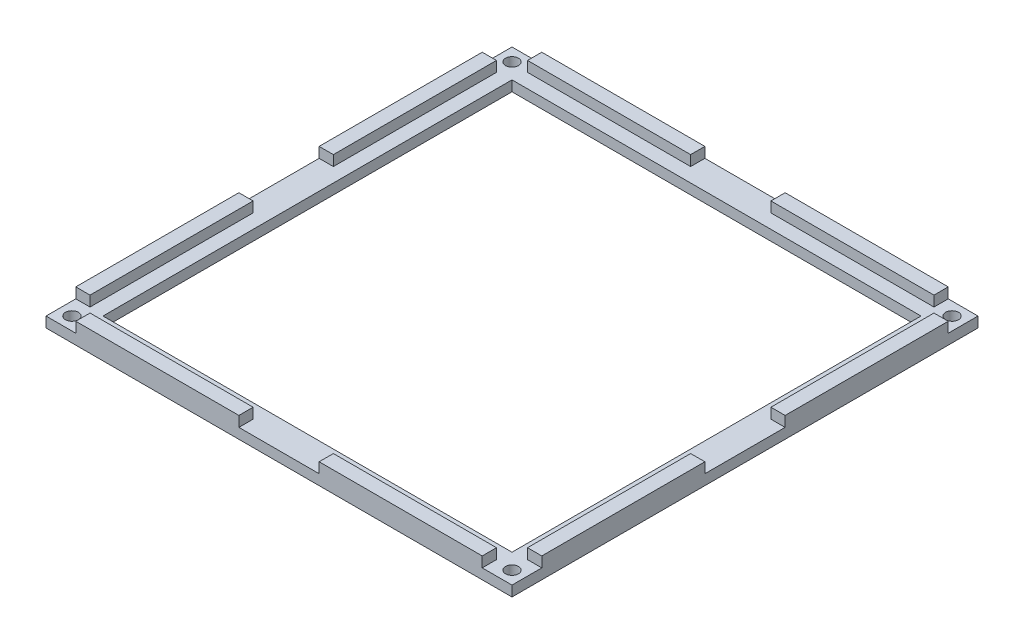
from build123d import *

# Parameters (mm, degrees)
CROQUIS1_W              = 180
CROQUIS1_H              = 180
CROQUIS1_R              = 2.5
CROQUIS1_W_2            = 158
CROQUIS1_H_2            = 158
SALIENTE_EXTRUIR1_DEPTH = 4
CROQUIS2_W              = 5.5
CROQUIS2_H              = 63
CROQUIS2_W_2            = 63
CROQUIS2_H_2            = 5.5
SALIENTE_EXTRUIR2_DEPTH = 4


with BuildPart() as part:
    # Croquis1 → Saliente-Extruir1 (new body)
    with BuildSketch(Plane(origin=(0, 0, 0), x_dir=(1, 0, 0), z_dir=(0, 1, 0))):
        with Locations((90, 90)):
            Rectangle(CROQUIS1_W, CROQUIS1_H)
        with Locations(Location((5, 175, 0), (0, 0, 270))):
            Circle(CROQUIS1_R, mode=Mode.SUBTRACT)
        with Locations(Location((175, 175, 0), (0, 0, 270))):
            Circle(CROQUIS1_R, mode=Mode.SUBTRACT)
        with Locations(Location((175, 5, 0), (0, 0, 270))):
            Circle(CROQUIS1_R, mode=Mode.SUBTRACT)
        with Locations(Location((5, 5, 0), (0, 0, 270))):
            Circle(CROQUIS1_R, mode=Mode.SUBTRACT)
        with Locations((90, 90)):
            Rectangle(CROQUIS1_W_2, CROQUIS1_H_2, mode=Mode.SUBTRACT)
    extrude(amount=SALIENTE_EXTRUIR1_DEPTH)

    # Croquis2 → Saliente-Extruir2 (add)
    with BuildSketch(Plane(origin=(0, 4, 0), x_dir=(1, 0, 0), z_dir=(0, 1, 0))):
        with Locations((2.75, 137)):
            Rectangle(CROQUIS2_W, CROQUIS2_H)
        with Locations((43, 177.25)):
            Rectangle(CROQUIS2_W_2, CROQUIS2_H_2)
        with Locations((137, 177.25)):
            Rectangle(CROQUIS2_W_2, CROQUIS2_H_2)
        with Locations((177.25, 137)):
            Rectangle(CROQUIS2_W, CROQUIS2_H)
        with Locations((177.25, 43)):
            Rectangle(CROQUIS2_W, CROQUIS2_H)
        with Locations((137, 2.75)):
            Rectangle(CROQUIS2_W_2, CROQUIS2_H_2)
        with Locations((43, 2.75)):
            Rectangle(CROQUIS2_W_2, CROQUIS2_H_2)
        with Locations((2.75, 43)):
            Rectangle(CROQUIS2_W, CROQUIS2_H)
    extrude(amount=SALIENTE_EXTRUIR2_DEPTH)


solid = part.part
